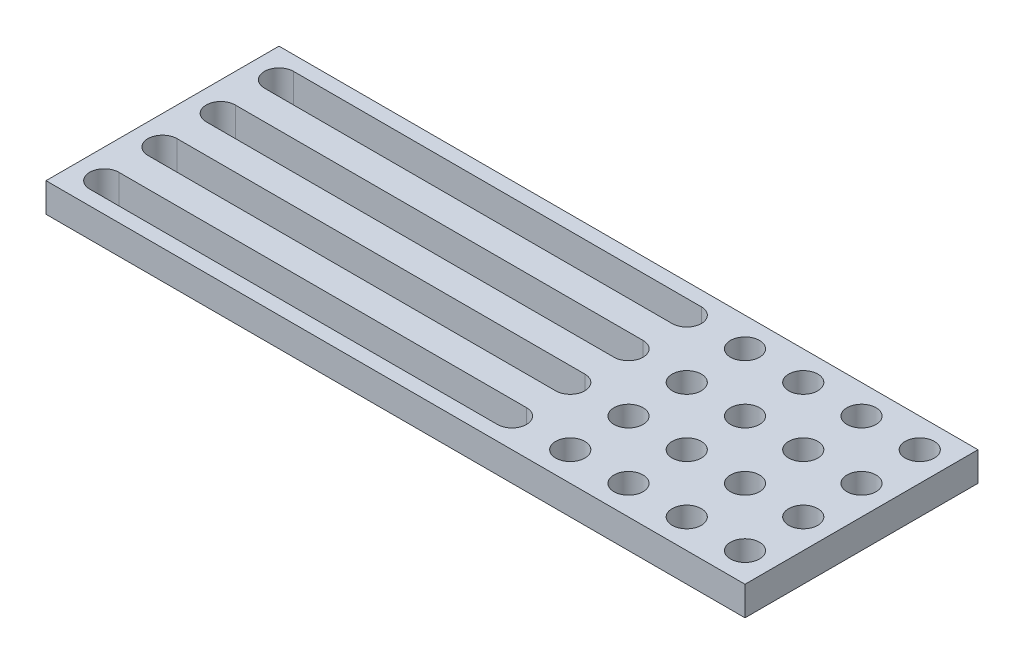
from build123d import *

# Parameters (mm, degrees)
SKETCH1_W           = 152.4
SKETCH1_H           = 50.8
SKETCH1_R           = 3.175
BOSS_EXTRUDE1_DEPTH = 6.35


with BuildPart() as part:
    # Sketch1 → Boss-Extrude1 (new body)
    with BuildSketch(Plane(origin=(0, 0, 0), x_dir=(1, 0, 0), z_dir=(0, 1, 0))):
        Rectangle(SKETCH1_W, SKETCH1_H)
        with Locations(Location((31.75, 19.05, 0), (0, 0, 270))):
            Circle(SKETCH1_R, mode=Mode.SUBTRACT)
        with Locations(Location((44.45, 19.05, 0), (0, 0, 270))):
            Circle(SKETCH1_R, mode=Mode.SUBTRACT)
        with Locations(Location((57.15, 19.05, 0), (0, 0, 270))):
            Circle(SKETCH1_R, mode=Mode.SUBTRACT)
        with Locations(Location((31.75, 6.35, 0), (0, 0, 270))):
            Circle(SKETCH1_R, mode=Mode.SUBTRACT)
        with Locations(Location((44.45, 6.35, 0), (0, 0, 270))):
            Circle(SKETCH1_R, mode=Mode.SUBTRACT)
        with Locations(Location((57.15, 6.35, 0), (0, 0, 270))):
            Circle(SKETCH1_R, mode=Mode.SUBTRACT)
        with Locations(Location((69.85, 6.35, 0), (0, 0, 270))):
            Circle(SKETCH1_R, mode=Mode.SUBTRACT)
        with Locations(Location((31.75, -6.35, 0), (0, 0, 270))):
            Circle(SKETCH1_R, mode=Mode.SUBTRACT)
        with Locations(Location((44.45, -6.35, 0), (0, 0, 270))):
            Circle(SKETCH1_R, mode=Mode.SUBTRACT)
        with Locations(Location((57.15, -6.35, 0), (0, 0, 270))):
            Circle(SKETCH1_R, mode=Mode.SUBTRACT)
        with Locations(Location((69.85, -6.35, 0), (0, 0, 270))):
            Circle(SKETCH1_R, mode=Mode.SUBTRACT)
        with Locations(Location((31.75, -19.05, 0), (0, 0, 270))):
            Circle(SKETCH1_R, mode=Mode.SUBTRACT)
        with Locations(Location((69.85, 19.05, 0), (0, 0, 270))):
            Circle(SKETCH1_R, mode=Mode.SUBTRACT)
        with Locations(Location((44.45, -19.05, 0), (0, 0, 270))):
            Circle(SKETCH1_R, mode=Mode.SUBTRACT)
        with Locations(Location((57.15, -19.05, 0), (0, 0, 270))):
            Circle(SKETCH1_R, mode=Mode.SUBTRACT)
        with Locations(Location((69.85, -19.05, 0), (0, 0, 270))):
            Circle(SKETCH1_R, mode=Mode.SUBTRACT)
        with BuildLine():
            Line((-69.85, 22.225), (19.05, 22.225))
            ThreePointArc((19.05, 22.225), (22.225, 19.05), (19.05, 15.875))
            Line((19.05, 15.875), (-69.85, 15.875))
            ThreePointArc((-69.85, 15.875), (-73.025, 19.05), (-69.85, 22.225))
        make_face(mode=Mode.SUBTRACT)
        with BuildLine():
            Line((19.05, 3.175), (-69.85, 3.175))
            ThreePointArc((-69.85, 3.175), (-73.025, 6.35), (-69.85, 9.525))
            Line((-69.85, 9.525), (19.05, 9.525))
            ThreePointArc((19.05, 9.525), (22.225, 6.35), (19.05, 3.175))
        make_face(mode=Mode.SUBTRACT)
        with BuildLine():
            Line((19.05, -9.525), (-69.85, -9.525))
            ThreePointArc((-69.85, -9.525), (-73.025, -6.35), (-69.85, -3.175))
            Line((-69.85, -3.175), (19.05, -3.175))
            ThreePointArc((19.05, -3.175), (22.225, -6.35), (19.05, -9.525))
        make_face(mode=Mode.SUBTRACT)
        with BuildLine():
            Line((19.05, -22.225), (-69.85, -22.225))
            ThreePointArc((-69.85, -22.225), (-73.025, -19.05), (-69.85, -15.875))
            Line((-69.85, -15.875), (19.05, -15.875))
            ThreePointArc((19.05, -15.875), (22.225, -19.05), (19.05, -22.225))
        make_face(mode=Mode.SUBTRACT)
    extrude(amount=BOSS_EXTRUDE1_DEPTH)


solid = part.part
